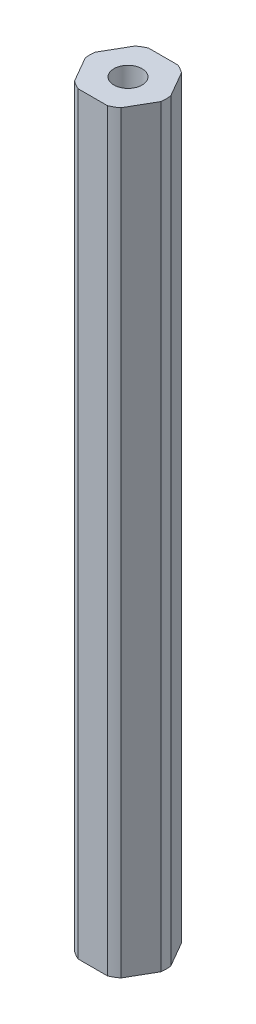
from build123d import *

# Parameters (mm, degrees)
SKETCH1_R           = 2.5527
BOSS_EXTRUDE1_DEPTH = 67.945


with BuildPart() as part:
    # Sketch1 → Boss-Extrude1 (new, symmetric)
    with BuildSketch(Plane(origin=(0, 0, 0), x_dir=(1, 0, 0), z_dir=(0, 1, 0))):
        with BuildLine():
            ThreePointArc((2.637015474, -6.35), (3.43789, -5.954600151), (4.180753577, -5.45872239))
            Line((4.180753577, -5.45872239), (6.817769051, -0.89127761))
            ThreePointArc((6.817769051, -0.89127761), (6.861261935, -0.446581753), (6.87578, 0))
            ThreePointArc((6.87578, 0), (6.861261935, 0.446581753), (6.817769051, 0.89127761))
            Line((6.817769051, 0.89127761), (4.180753577, 5.45872239))
            ThreePointArc((4.180753577, 5.45872239), (3.43789, 5.954600151), (2.637015474, 6.35))
            Line((2.637015474, 6.35), (-2.637015474, 6.35))
            ThreePointArc((-2.637015474, 6.35), (-3.43789, 5.954600151), (-4.180753577, 5.45872239))
            Line((-4.180753577, 5.45872239), (-6.817769051, 0.89127761))
            ThreePointArc((-6.817769051, 0.89127761), (-6.87578, 0), (-6.817769051, -0.89127761))
            Line((-6.817769051, -0.89127761), (-4.180753577, -5.45872239))
            ThreePointArc((-4.180753577, -5.45872239), (-3.43789, -5.954600151), (-2.637015474, -6.35))
            Line((-2.637015474, -6.35), (2.637015474, -6.35))
        make_face()
        with Locations(Location((0, 0, 0), (0, 0, 270))):
            Circle(SKETCH1_R, mode=Mode.SUBTRACT)
    extrude(amount=BOSS_EXTRUDE1_DEPTH, both=True)


solid = part.part
